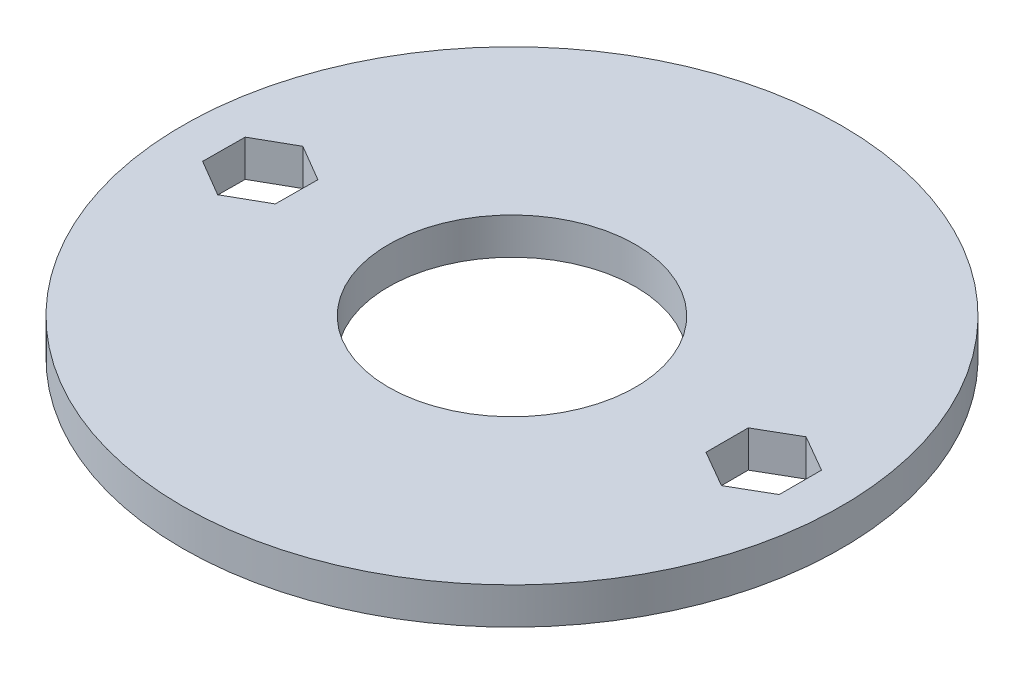
from build123d import *

# Parameters (mm, degrees)
SKETCH1_R           = 36
BOSS_EXTRUDE1_DEPTH = 4
CUT_EXTRUDE1_DEPTH  = 52.068581339
SKETCH3_R           = 13.5
CUT_EXTRUDE2_DEPTH  = 52.068581339


with BuildPart() as part:
    # Sketch1 → Boss-Extrude1 (new body)
    with BuildSketch(Plane(origin=(0, 0, 0), x_dir=(1, 0, 0), z_dir=(0, 1, 0))):
        with Locations(Location((0, 0, 0), (0, 0, 270))):
            Circle(SKETCH1_R)
    extrude(amount=BOSS_EXTRUDE1_DEPTH)

    # Sketch2 → Cut-Extrude1 (cut, through all)
    with BuildSketch(Plane(origin=(0, 4, 0), x_dir=(1, 0, 0), z_dir=(0, 1, 0))):
        Polygon((-31.517749204, -2.278382028), (-27.535737886, -4.618663891), (-23.517988682, -2.340281863), (-23.482250796, 2.278382028), (-27.464262114, 4.618663891), (-31.482011318, 2.340281863), align=None)
        Polygon((27.5, -4.618802154), (31.5, -2.309401077), (31.5, 2.309401077), (27.5, 4.618802154), (23.5, 2.309401077), (23.5, -2.309401077), align=None)
    extrude(amount=-CUT_EXTRUDE1_DEPTH, mode=Mode.SUBTRACT)

    # Sketch3 → Cut-Extrude2 (cut, through all)
    with BuildSketch(Plane(origin=(0, 4, 0), x_dir=(1, 0, 0), z_dir=(0, 1, 0))):
        with Locations(Location((0, 0, 0), (0, 0, 270))):
            Circle(SKETCH3_R)
    extrude(amount=-CUT_EXTRUDE2_DEPTH, mode=Mode.SUBTRACT)


solid = part.part
